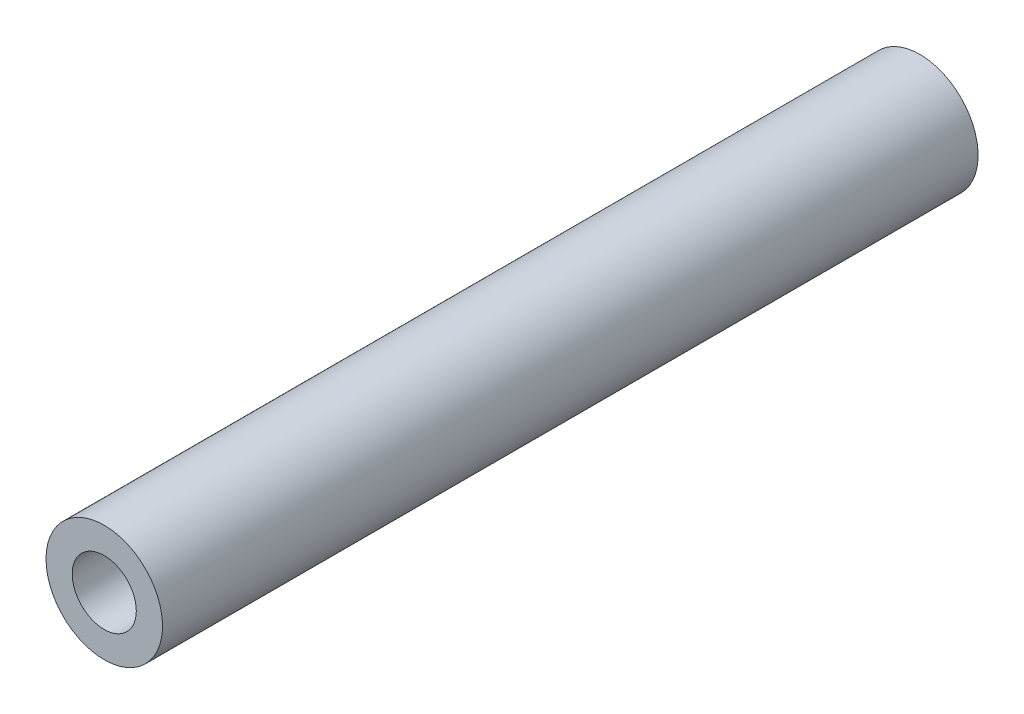
from build123d import *

# Parameters (mm, degrees)
SKETCH_1_R         = 3
EXTRUDE_1_DEPTH    = 42
HOLE_WIZARD_M4_1_D = 3.3


with BuildPart() as part:
    # 草图1 → 凸台-拉伸1 (new body)
    with BuildSketch(Plane.XY):
        with Locations(Location((0, 0, 0), (0, 0, 180))):
            Circle(SKETCH_1_R)
    extrude(amount=EXTRUDE_1_DEPTH)

    # M4 螺纹孔1 (through all)
    with Locations(Plane.XY.offset(42)):
        with Locations((0, 0)):
            Hole(HOLE_WIZARD_M4_1_D / 2)


solid = part.part
